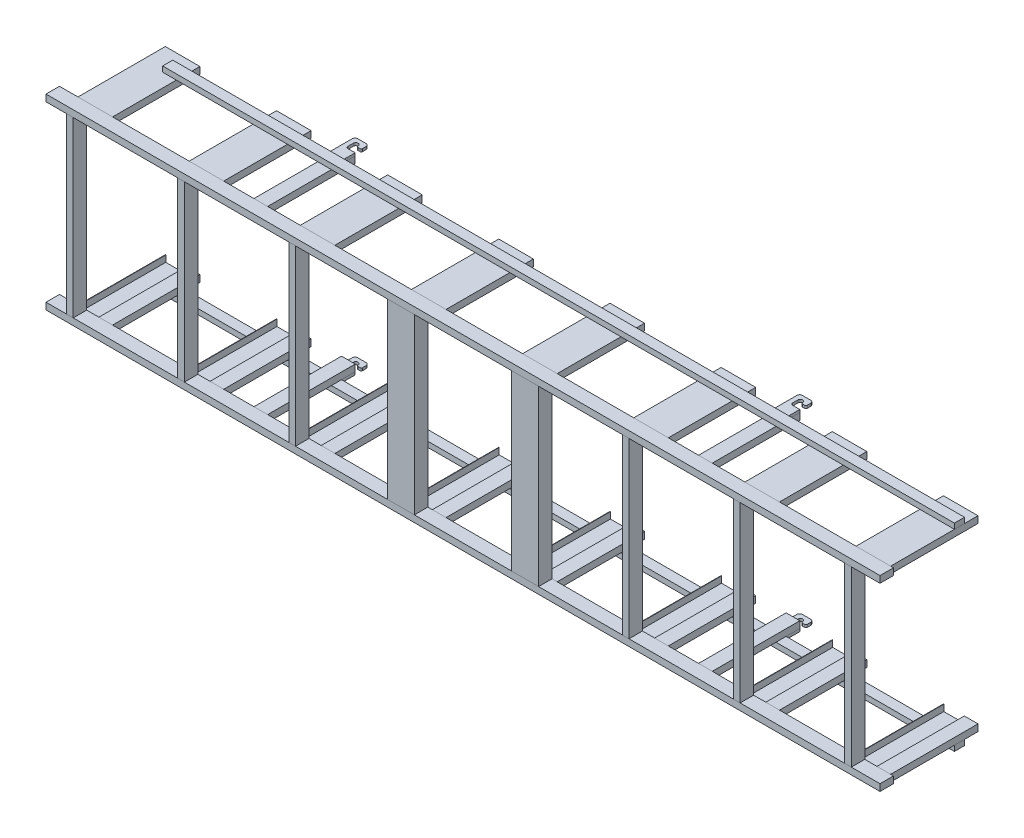
from build123d import *

# Parameters (mm, degrees)
SKETCH1_W              = 6190
SKETCH1_H              = 50
BOSS_EXTRUDE1_DEPTH    = 100
BOSS_EXTRUDE1_2_DEPTH  = 100
SKETCH2_W              = 200
SKETCH2_H              = 100
BOSS_EXTRUDE2_DEPTH    = 1388
BOSS_EXTRUDE2_2_DEPTH  = 1388
BOSS_EXTRUDE3_REACH    = 6335.746
SKETCH4_W              = 50
SKETCH4_H              = 100
BOSS_EXTRUDE4_DEPTH    = 648.4
BOSS_EXTRUDE4_2_DEPTH  = 648.4
BOSS_EXTRUDE4_3_DEPTH  = 648.4
BOSS_EXTRUDE4_4_DEPTH  = 648.4
BOSS_EXTRUDE4_5_DEPTH  = 648.4
BOSS_EXTRUDE4_6_DEPTH  = 648.4
BOSS_EXTRUDE4_7_DEPTH  = 648.4
BOSS_EXTRUDE4_8_DEPTH  = 648.4
BOSS_EXTRUDE4_9_DEPTH  = 648.4
BOSS_EXTRUDE4_10_DEPTH = 648.4
BOSS_EXTRUDE4_11_DEPTH = 648.4
BOSS_EXTRUDE4_12_DEPTH = 648.4
BOSS_EXTRUDE4_13_DEPTH = 648.4
BOSS_EXTRUDE4_14_DEPTH = 648.4
BOSS_EXTRUDE4_15_DEPTH = 648.4
BOSS_EXTRUDE4_16_DEPTH = 648.4
SKETCH8_W              = 101.6
SKETCH8_H              = 650
BOSS_EXTRUDE5_DEPTH    = 50
BOSS_EXTRUDE5_2_DEPTH  = 50
SKETCH9_W              = 101.6
SKETCH9_H              = 650
BOSS_EXTRUDE6_DEPTH    = 50
BOSS_EXTRUDE6_2_DEPTH  = 50
SKETCH10_W             = 75
SKETCH10_H             = 40
BOSS_EXTRUDE7_DEPTH    = 5876.6
BOSS_EXTRUDE7_2_DEPTH  = 5876.6
BOSS_EXTRUDE8_DEPTH    = 20
BOSS_EXTRUDE8_2_DEPTH  = 20
BOSS_EXTRUDE9_DEPTH    = 20
BOSS_EXTRUDE9_2_DEPTH  = 20


with BuildPart() as part:
    # Sketch1 → Boss-Extrude1 (new body)
    with BuildSketch(Plane.XY):
        with Locations((3095, 1363)):
            Rectangle(SKETCH1_W, SKETCH1_H)
    extrude(amount=BOSS_EXTRUDE1_DEPTH)


with BuildPart() as body_2:
    # Sketch1 → Boss-Extrude1 2 (new body)
    with BuildSketch(Plane.XY):
        with Locations((3095, 25)):
            Rectangle(SKETCH1_W, SKETCH1_H)
    extrude(amount=BOSS_EXTRUDE1_2_DEPTH)


with BuildPart() as body_3:
    # Sketch2 → Boss-Extrude2 (new body)
    with BuildSketch(Plane.XZ):
        with Locations((2634, 50)):
            Rectangle(SKETCH2_W, SKETCH2_H)
    extrude(amount=-BOSS_EXTRUDE2_DEPTH)


with BuildPart() as body_4:
    # Sketch2 → Boss-Extrude2 2 (new body)
    with BuildSketch(Plane.XZ):
        with Locations((3556, 50)):
            Rectangle(SKETCH2_W, SKETCH2_H)
    extrude(amount=-BOSS_EXTRUDE2_2_DEPTH)


with BuildPart() as body_5:

    # Sketch4 → Boss-Extrude3 (new, up to next)
    with BuildSketch(Plane(origin=(0, 50, 0), x_dir=(1, 0, 0), z_dir=(0, 1, 0)), mode=Mode.PRIVATE) as boss_extrude3_sk1:
        with Locations((177, -50)):
            Rectangle(SKETCH4_W, SKETCH4_H)
    boss_extrude3_tool1 = extrude(boss_extrude3_sk1.sketch, amount=BOSS_EXTRUDE3_REACH, mode=Mode.PRIVATE) - part.part
    # Sketch4 → Boss-Extrude3 (new, up to next)
    with BuildSketch(Plane(origin=(0, 50, 0), x_dir=(1, 0, 0), z_dir=(0, 1, 0)), mode=Mode.PRIVATE) as boss_extrude3_sk2:
        with Locations((1002, -50)):
            Rectangle(SKETCH4_W, SKETCH4_H)
    boss_extrude3_tool2 = extrude(boss_extrude3_sk2.sketch, amount=BOSS_EXTRUDE3_REACH, mode=Mode.PRIVATE) - part.part
    # Sketch4 → Boss-Extrude3 (new, up to next)
    with BuildSketch(Plane(origin=(0, 50, 0), x_dir=(1, 0, 0), z_dir=(0, 1, 0)), mode=Mode.PRIVATE) as boss_extrude3_sk3:
        with Locations((1827, -50)):
            Rectangle(SKETCH4_W, SKETCH4_H)
    boss_extrude3_tool3 = extrude(boss_extrude3_sk3.sketch, amount=BOSS_EXTRUDE3_REACH, mode=Mode.PRIVATE) - part.part
    # Sketch4 → Boss-Extrude3 (new, up to next)
    with BuildSketch(Plane(origin=(0, 50, 0), x_dir=(1, 0, 0), z_dir=(0, 1, 0)), mode=Mode.PRIVATE) as boss_extrude3_sk4:
        with Locations((4302, -50)):
            Rectangle(SKETCH4_W, SKETCH4_H)
    boss_extrude3_tool4 = extrude(boss_extrude3_sk4.sketch, amount=BOSS_EXTRUDE3_REACH, mode=Mode.PRIVATE) - part.part
    # Sketch4 → Boss-Extrude3 (new, up to next)
    with BuildSketch(Plane(origin=(0, 50, 0), x_dir=(1, 0, 0), z_dir=(0, 1, 0)), mode=Mode.PRIVATE) as boss_extrude3_sk5:
        with Locations((5127, -50)):
            Rectangle(SKETCH4_W, SKETCH4_H)
    boss_extrude3_tool5 = extrude(boss_extrude3_sk5.sketch, amount=BOSS_EXTRUDE3_REACH, mode=Mode.PRIVATE) - part.part
    # Sketch4 → Boss-Extrude3 (new, up to next)
    with BuildSketch(Plane(origin=(0, 50, 0), x_dir=(1, 0, 0), z_dir=(0, 1, 0)), mode=Mode.PRIVATE) as boss_extrude3_sk6:
        with Locations((5952, -50)):
            Rectangle(SKETCH4_W, SKETCH4_H)
    boss_extrude3_tool6 = extrude(boss_extrude3_sk6.sketch, amount=BOSS_EXTRUDE3_REACH, mode=Mode.PRIVATE) - part.part
    add(boss_extrude3_tool1.solids().sort_by_distance((177, 50, 50))[0])
    add(boss_extrude3_tool2.solids().sort_by_distance((1002, 50, 50))[0])
    add(boss_extrude3_tool3.solids().sort_by_distance((1827, 50, 50))[0])
    add(boss_extrude3_tool4.solids().sort_by_distance((4302, 50, 50))[0])
    add(boss_extrude3_tool5.solids().sort_by_distance((5127, 50, 50))[0])
    add(boss_extrude3_tool6.solids().sort_by_distance((5952, 50, 50))[0])


with BuildPart() as body_6:
    # Sketch5 → Boss-Extrude4 (new body)
    with BuildSketch(Plane.XY):
        Polygon((137.4, 1388), (137.4, 1338), (140.4, 1338), (140.4, 1385.8), (292.4, 1385.8), (292.4, 1338), (394, 1338), (394, 1388), align=None)
    extrude(amount=-BOSS_EXTRUDE4_DEPTH)


with BuildPart() as body_7:
    # Sketch5 → Boss-Extrude4 2 (new body)
    with BuildSketch(Plane.XY):
        Polygon((962.4, 1388), (962.4, 1338), (965.4, 1338), (965.4, 1385.8), (1117.4, 1385.8), (1117.4, 1338), (1219, 1338), (1219, 1388), align=None)
    extrude(amount=-BOSS_EXTRUDE4_2_DEPTH)


with BuildPart() as body_8:
    # Sketch5 → Boss-Extrude4 3 (new body)
    with BuildSketch(Plane.XY):
        Polygon((1787.4, 1388), (1787.4, 1338), (1790.4, 1338), (1790.4, 1385.8), (1942.4, 1385.8), (1942.4, 1338), (2044, 1338), (2044, 1388), align=None)
    extrude(amount=-BOSS_EXTRUDE4_3_DEPTH)


with BuildPart() as body_9:
    # Sketch5 → Boss-Extrude4 4 (new body)
    with BuildSketch(Plane.XY):
        Polygon((2612.4, 1388), (2612.4, 1338), (2615.4, 1338), (2615.4, 1385.8), (2767.4, 1385.8), (2767.4, 1338), (2869, 1338), (2869, 1388), align=None)
    extrude(amount=-BOSS_EXTRUDE4_4_DEPTH)


with BuildPart() as body_10:
    # Sketch5 → Boss-Extrude4 5 (new body)
    with BuildSketch(Plane.XY):
        Polygon((3437.4, 1388), (3437.4, 1338), (3440.4, 1338), (3440.4, 1385.8), (3592.4, 1385.8), (3592.4, 1338), (3694, 1338), (3694, 1388), align=None)
    extrude(amount=-BOSS_EXTRUDE4_5_DEPTH)


with BuildPart() as body_11:
    # Sketch5 → Boss-Extrude4 6 (new body)
    with BuildSketch(Plane.XY):
        Polygon((4262.4, 1388), (4262.4, 1338), (4265.4, 1338), (4265.4, 1385.8), (4417.4, 1385.8), (4417.4, 1338), (4519, 1338), (4519, 1388), align=None)
    extrude(amount=-BOSS_EXTRUDE4_6_DEPTH)


with BuildPart() as body_12:
    # Sketch5 → Boss-Extrude4 7 (new body)
    with BuildSketch(Plane.XY):
        Polygon((5087.4, 1388), (5087.4, 1338), (5090.4, 1338), (5090.4, 1385.8), (5242.4, 1385.8), (5242.4, 1338), (5344, 1338), (5344, 1388), align=None)
    extrude(amount=-BOSS_EXTRUDE4_7_DEPTH)


with BuildPart() as body_13:
    # Sketch5 → Boss-Extrude4 8 (new body)
    with BuildSketch(Plane.XY):
        Polygon((5912.4, 1388), (5912.4, 1338), (5915.4, 1338), (5915.4, 1385.8), (6067.4, 1385.8), (6067.4, 1338), (6169, 1338), (6169, 1388), align=None)
    extrude(amount=-BOSS_EXTRUDE4_8_DEPTH)


with BuildPart() as body_14:
    # Sketch5 → Boss-Extrude4 9 (new body)
    with BuildSketch(Plane.XY):
        Polygon((6067.4, 2.2), (6067.4, 50), (6169, 50), (6169, 0), (5912.4, 0), (5912.4, 50), (5915.4, 50), (5915.4, 2.2), align=None)
    extrude(amount=-BOSS_EXTRUDE4_9_DEPTH)


with BuildPart() as body_15:
    # Sketch5 → Boss-Extrude4 10 (new body)
    with BuildSketch(Plane.XY):
        Polygon((5242.4, 2.2), (5242.4, 50), (5344, 50), (5344, 0), (5087.4, 0), (5087.4, 50), (5090.4, 50), (5090.4, 2.2), align=None)
    extrude(amount=-BOSS_EXTRUDE4_10_DEPTH)


with BuildPart() as body_16:
    # Sketch5 → Boss-Extrude4 11 (new body)
    with BuildSketch(Plane.XY):
        Polygon((4417.4, 2.2), (4417.4, 50), (4519, 50), (4519, 0), (4262.4, 0), (4262.4, 50), (4265.4, 50), (4265.4, 2.2), align=None)
    extrude(amount=-BOSS_EXTRUDE4_11_DEPTH)


with BuildPart() as body_17:
    # Sketch5 → Boss-Extrude4 12 (new body)
    with BuildSketch(Plane.XY):
        Polygon((3592.4, 2.2), (3592.4, 50), (3694, 50), (3694, 0), (3437.4, 0), (3437.4, 50), (3440.4, 50), (3440.4, 2.2), align=None)
    extrude(amount=-BOSS_EXTRUDE4_12_DEPTH)


with BuildPart() as body_18:
    # Sketch5 → Boss-Extrude4 13 (new body)
    with BuildSketch(Plane.XY):
        Polygon((2767.4, 2.2), (2767.4, 50), (2869, 50), (2869, 0), (2612.4, 0), (2612.4, 50), (2615.4, 50), (2615.4, 2.2), align=None)
    extrude(amount=-BOSS_EXTRUDE4_13_DEPTH)


with BuildPart() as body_19:
    # Sketch5 → Boss-Extrude4 14 (new body)
    with BuildSketch(Plane.XY):
        Polygon((1942.4, 2.2), (1942.4, 50), (2044, 50), (2044, 0), (1787.4, 0), (1787.4, 50), (1790.4, 50), (1790.4, 2.2), align=None)
    extrude(amount=-BOSS_EXTRUDE4_14_DEPTH)


with BuildPart() as body_20:
    # Sketch5 → Boss-Extrude4 15 (new body)
    with BuildSketch(Plane.XY):
        Polygon((1117.4, 2.2), (1117.4, 50), (1219, 50), (1219, 0), (962.4, 0), (962.4, 50), (965.4, 50), (965.4, 2.2), align=None)
    extrude(amount=-BOSS_EXTRUDE4_15_DEPTH)


with BuildPart() as body_21:
    # Sketch5 → Boss-Extrude4 16 (new body)
    with BuildSketch(Plane.XY):
        Polygon((292.4, 2.2), (292.4, 50), (394, 50), (394, 0), (137.4, 0), (137.4, 50), (140.4, 50), (140.4, 2.2), align=None)
    extrude(amount=-BOSS_EXTRUDE4_16_DEPTH)


with BuildPart() as body_22:
    # Sketch8 → Boss-Extrude5 (new body)
    with BuildSketch(Plane(origin=(0, 50, 0), x_dir=(1, 0, 0), z_dir=(0, 1, 0))):
        with Locations((1494.2, 325)):
            Rectangle(SKETCH8_W, SKETCH8_H)
    extrude(amount=-BOSS_EXTRUDE5_DEPTH)


with BuildPart() as body_23:
    # Sketch8 → Boss-Extrude5 2 (new body)
    with BuildSketch(Plane(origin=(0, 50, 0), x_dir=(1, 0, 0), z_dir=(0, 1, 0))):
        with Locations((4794.2, 325)):
            Rectangle(SKETCH8_W, SKETCH8_H)
    extrude(amount=-BOSS_EXTRUDE5_2_DEPTH)


with BuildPart() as body_24:
    # Sketch9 → Boss-Extrude6 (new body)
    with BuildSketch(Plane(origin=(0, 1388, 0), x_dir=(1, 0, 0), z_dir=(0, 1, 0))):
        with Locations((1494.2, 325)):
            Rectangle(SKETCH9_W, SKETCH9_H)
    extrude(amount=-BOSS_EXTRUDE6_DEPTH)


with BuildPart() as body_25:
    # Sketch9 → Boss-Extrude6 2 (new body)
    with BuildSketch(Plane(origin=(0, 1388, 0), x_dir=(1, 0, 0), z_dir=(0, 1, 0))):
        with Locations((4794.2, 325)):
            Rectangle(SKETCH9_W, SKETCH9_H)
    extrude(amount=-BOSS_EXTRUDE6_2_DEPTH)


with BuildPart() as body_26:
    # Sketch10 → Boss-Extrude7 (new body)
    with BuildSketch(Plane(origin=(6169, 0, 0), x_dir=(0, 0, -1), z_dir=(1, 0, 0))):
        with Locations((510.9, -20)):
            Rectangle(SKETCH10_W, SKETCH10_H)
    extrude(amount=-BOSS_EXTRUDE7_DEPTH)


with BuildPart() as body_27:
    # Sketch10 → Boss-Extrude7 2 (new body)
    with BuildSketch(Plane(origin=(6169, 0, 0), x_dir=(0, 0, -1), z_dir=(1, 0, 0))):
        with Locations((510.9, 1408)):
            Rectangle(SKETCH10_W, SKETCH10_H)
    extrude(amount=-BOSS_EXTRUDE7_2_DEPTH)


with BuildPart() as body_28:
    # Sketch11 → Boss-Extrude8 (new body)
    with BuildSketch(Plane.XZ):
        with BuildLine():
            Line((4845, -650), (4791.262886355, -650))
            ThreePointArc((4791.262886355, -650), (4780.656284637, -654.393398282), (4776.262886355, -665))
            Line((4776.262886355, -665), (4776.262886355, -705))
            ThreePointArc((4776.262886355, -705), (4793.762886355, -722.5), (4811.262886355, -705))
            ThreePointArc((4811.262886355, -705), (4814.191818543, -697.928932188), (4821.262886355, -695))
            Line((4821.262886355, -695), (4835.362886355, -695))
            ThreePointArc((4835.362886355, -695), (4842.433954167, -697.928932188), (4845.362886355, -705))
            Line((4845.362886355, -705), (4845.362886355, -730))
            ThreePointArc((4845.362886355, -730), (4839.505021978, -744.142135624), (4825.362886355, -750))
            Line((4825.362886355, -750), (4763.762886355, -750))
            ThreePointArc((4763.762886355, -750), (4749.421602074, -744.235319602), (4743.4, -730.000001434))
            Line((4743.4, -730.000001434), (4743.4, -550))
            Line((4743.4, -550), (4845, -550))
            Line((4845, -550), (4845, -650))
        make_face()
    extrude(amount=BOSS_EXTRUDE8_DEPTH)


with BuildPart() as body_29:
    # Sketch11 → Boss-Extrude8 2 (new body)
    with BuildSketch(Plane.XZ):
        with BuildLine():
            Line((1545, -650), (1491.262886355, -650))
            ThreePointArc((1491.262886355, -650), (1480.656284637, -654.393398282), (1476.262886355, -665))
            Line((1476.262886355, -665), (1476.262886355, -705))
            ThreePointArc((1476.262886355, -705), (1493.762886355, -722.5), (1511.262886355, -705))
            ThreePointArc((1511.262886355, -705), (1514.191818543, -697.928932188), (1521.262886355, -695))
            Line((1521.262886355, -695), (1535.362886355, -695))
            ThreePointArc((1535.362886355, -695), (1542.433954167, -697.928932188), (1545.362886355, -705))
            Line((1545.362886355, -705), (1545.362886355, -730))
            ThreePointArc((1545.362886355, -730), (1539.505021978, -744.142135624), (1525.362886355, -750))
            Line((1525.362886355, -750), (1463.762886355, -750))
            ThreePointArc((1463.762886355, -750), (1449.421602074, -744.235319602), (1443.4, -730.000001434))
            Line((1443.4, -730.000001434), (1443.4, -550))
            Line((1443.4, -550), (1545, -550))
            Line((1545, -550), (1545, -650))
        make_face()
    extrude(amount=BOSS_EXTRUDE8_2_DEPTH)


with BuildPart() as body_30:
    # Sketch12 → Boss-Extrude9 (new body)
    with BuildSketch(Plane(origin=(0, 1388, 0), x_dir=(1, 0, 0), z_dir=(0, 1, 0))):
        with BuildLine():
            Line((4743.399964851, 730.000247411), (4743.399964851, 550.000245978))
            Line((4743.399964851, 550.000245978), (4844.999964851, 550.000245978))
            Line((4844.999964851, 550.000245978), (4844.999964851, 650.000245978))
            Line((4844.999964851, 650.000245978), (4791.262851206, 650.000245978))
            ThreePointArc((4791.262851206, 650.000245978), (4780.656249488, 654.39364426), (4776.262851206, 665.000245978))
            Line((4776.262851206, 665.000245978), (4776.262851206, 705.000245978))
            ThreePointArc((4776.262851206, 705.000245978), (4793.762851206, 722.500245978), (4811.262851206, 705.000245978))
            ThreePointArc((4811.262851206, 705.000245978), (4814.191783394, 697.929178166), (4821.262851206, 695.000245978))
            Line((4821.262851206, 695.000245978), (4835.362851206, 695.000245978))
            ThreePointArc((4835.362851206, 695.000245978), (4842.433919018, 697.929178166), (4845.362851206, 705.000245978))
            Line((4845.362851206, 705.000245978), (4845.362851206, 730.000245978))
            ThreePointArc((4845.362851206, 730.000245978), (4839.504986829, 744.142381601), (4825.362851206, 750.000245978))
            Line((4825.362851206, 750.000245978), (4763.762851206, 750.000245978))
            ThreePointArc((4763.762851206, 750.000245978), (4749.421566925, 744.23556558), (4743.399964851, 730.000247411))
        make_face()
    extrude(amount=BOSS_EXTRUDE9_DEPTH)


with BuildPart() as body_31:
    # Sketch12 → Boss-Extrude9 2 (new body)
    with BuildSketch(Plane(origin=(0, 1388, 0), x_dir=(1, 0, 0), z_dir=(0, 1, 0))):
        with BuildLine():
            Line((1544.999964851, 550.000245978), (1443.399964851, 550.000245978))
            Line((1443.399964851, 550.000245978), (1443.399964851, 730.000247411))
            ThreePointArc((1443.399964851, 730.000247411), (1449.421566925, 744.23556558), (1463.762851206, 750.000245978))
            Line((1463.762851206, 750.000245978), (1525.362851206, 750.000245978))
            ThreePointArc((1525.362851206, 750.000245978), (1539.504986829, 744.142381601), (1545.362851206, 730.000245978))
            Line((1545.362851206, 730.000245978), (1545.362851206, 705.000245978))
            ThreePointArc((1545.362851206, 705.000245978), (1542.433919018, 697.929178166), (1535.362851206, 695.000245978))
            Line((1535.362851206, 695.000245978), (1521.262851206, 695.000245978))
            ThreePointArc((1521.262851206, 695.000245978), (1514.191783394, 697.929178166), (1511.262851206, 705.000245978))
            ThreePointArc((1511.262851206, 705.000245978), (1493.762851206, 722.500245978), (1476.262851206, 705.000245978))
            Line((1476.262851206, 705.000245978), (1476.262851206, 665.000245978))
            ThreePointArc((1476.262851206, 665.000245978), (1480.656249488, 654.39364426), (1491.262851206, 650.000245978))
            Line((1491.262851206, 650.000245978), (1544.999964851, 650.000245978))
            Line((1544.999964851, 650.000245978), (1544.999964851, 550.000245978))
        make_face()
    extrude(amount=BOSS_EXTRUDE9_2_DEPTH)


solid = Compound([part.part, body_2.part, body_3.part, body_4.part, body_5.part, body_6.part, body_7.part, body_8.part, body_9.part, body_10.part, body_11.part, body_12.part, body_13.part, body_14.part, body_15.part, body_16.part, body_17.part, body_18.part, body_19.part, body_20.part, body_21.part, body_22.part, body_23.part, body_24.part, body_25.part, body_26.part, body_27.part, body_28.part, body_29.part, body_30.part, body_31.part])
